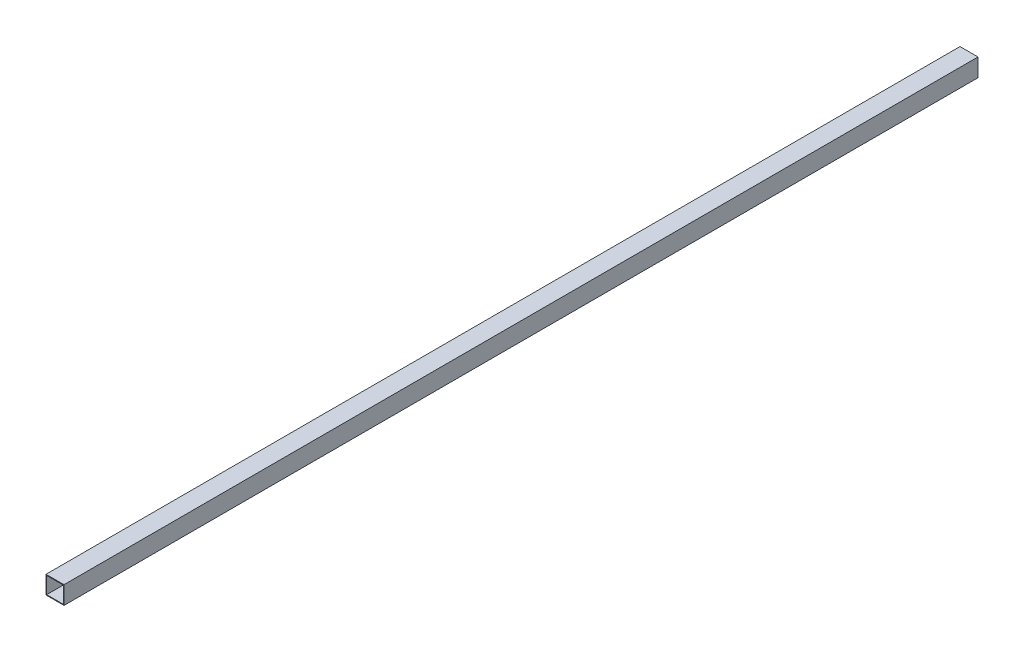
from build123d import *

# Parameters (mm, degrees)
BOSS_EXTRUDE1_DEPTH      = 580
BOSS_EXTRUDE1_DEPTH_BACK = 80
SKETCH1_W                = 13
SKETCH1_H                = 13
SKETCH1_W_2              = 12
SKETCH1_H_2              = 12


with BuildPart() as part:
    # Sketch1 → Boss-Extrude1 (new, two sides: drawn at the far end of the back side and taken through both)
    with BuildSketch(Plane.XY.offset(-BOSS_EXTRUDE1_DEPTH_BACK)):
        Rectangle(SKETCH1_W, SKETCH1_H)
        Rectangle(SKETCH1_W_2, SKETCH1_H_2, mode=Mode.SUBTRACT)
    extrude(amount=BOSS_EXTRUDE1_DEPTH + BOSS_EXTRUDE1_DEPTH_BACK)


solid = part.part
